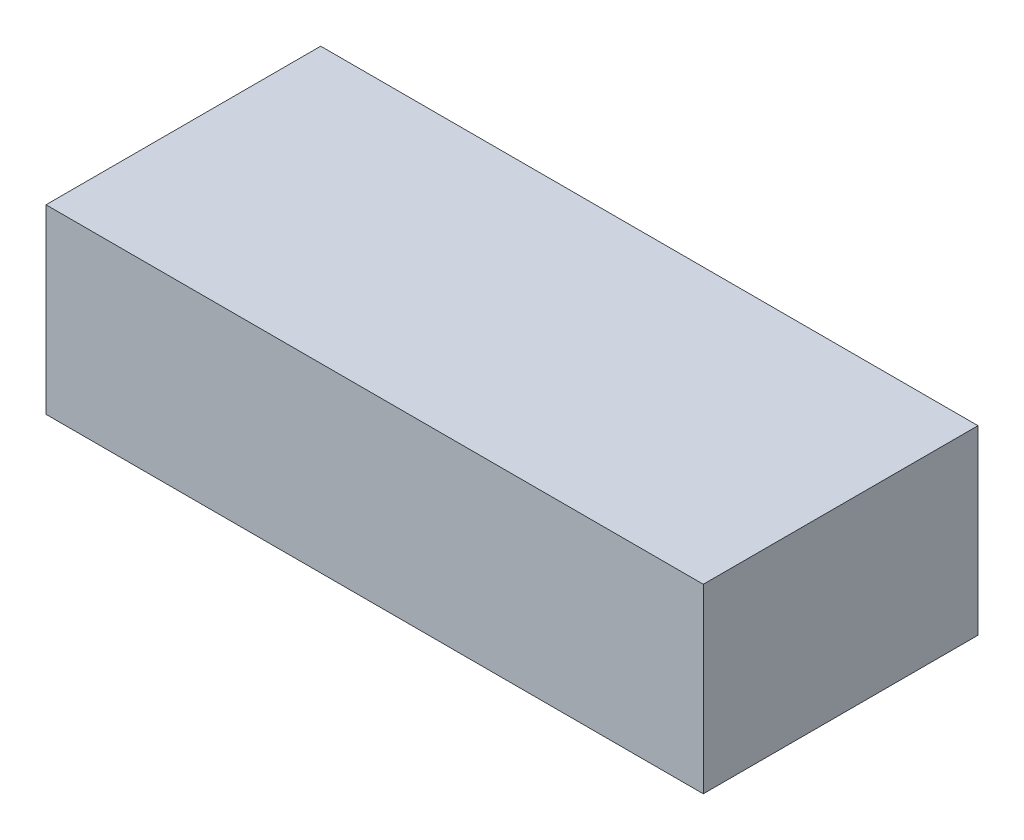
from build123d import *

# Parameters (mm, degrees)
SKETCH_1_W      = 134
SKETCH_1_H      = 37
EXTRUDE_1_DEPTH = 56


with BuildPart() as part:
    # 草图1 → 凸台-拉伸1 (new body)
    with BuildSketch(Plane.XY):
        Rectangle(SKETCH_1_W, SKETCH_1_H)
    extrude(amount=EXTRUDE_1_DEPTH)


solid = part.part
